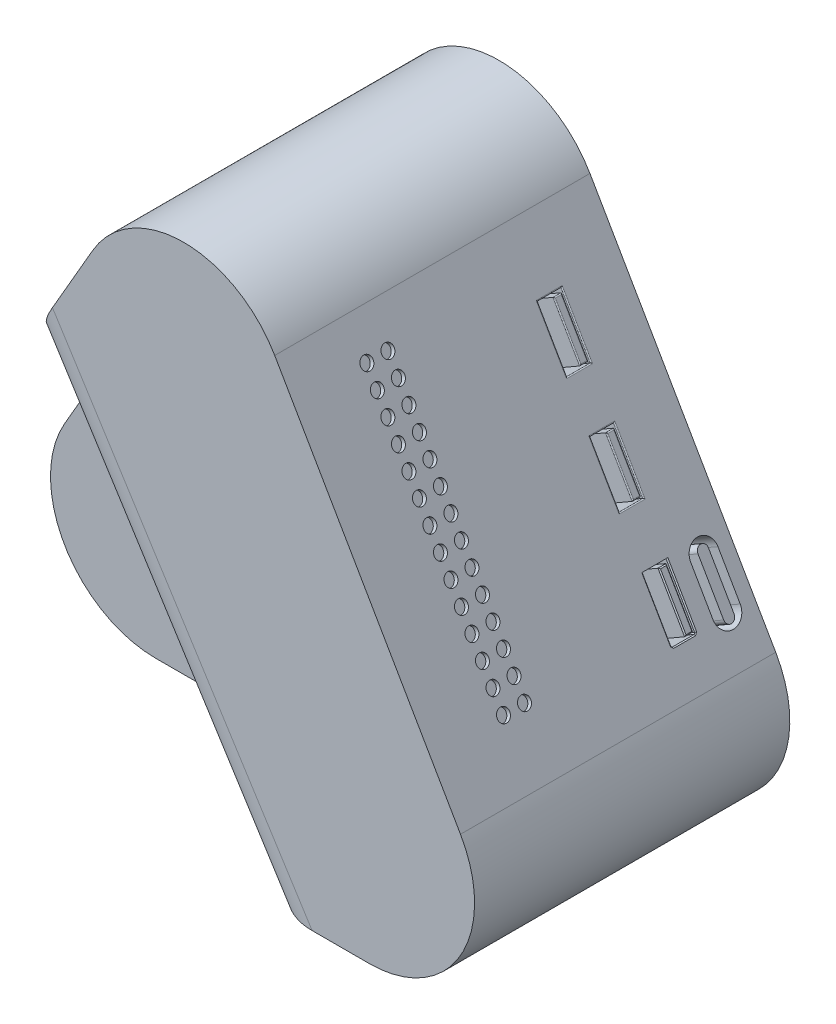
from build123d import *

# Parameters (mm, degrees)
BOSS_EXTRUDE1_DEPTH = 30
SKETCH2_W           = 2.275234404095272
SKETCH2_H           = 5.578757672765283
SKETCH2_H_2         = 5.578757672765278
SKETCH2_W_2         = 2.275234404095273
CUT_EXTRUDE1_DEPTH  = 5
SKETCH3_W           = 0.76212713524626
SKETCH3_H           = 5.066614641044968
SKETCH3_W_2         = 0.7621271352462609
SKETCH3_H_2         = 5.066614641044964
BOSS_EXTRUDE3_DEPTH = 5
CHAMFER2_SIZE       = 0.1
FILLET1_R           = 0.1
FILLET2_R           = 0.1
FILLET3_R           = 0.1
FILLET4_R           = 0.1
CUT_EXTRUDE2_DEPTH  = 5
BOSS_EXTRUDE4_DEPTH = 5
CUT_EXTRUDE3_START  = -15.000000000000002
CUT_EXTRUDE3_DEPTH  = 15.000000000000002
SKETCH7_W           = 4.440002623823602
SKETCH7_H           = 5.125420819496185
BOSS_EXTRUDE5_DEPTH = 0.4
SKETCH8_R           = 0.5886376526308733
BOSS_EXTRUDE6_DEPTH = 0.4
FILLET7_R           = 4
SKETCH10_R          = 0.5938831394244329
SKETCH10_R_2        = 0.5938831394244335
SKETCH10_R_3        = 0.5938831394244324
CUT_EXTRUDE4_DEPTH  = 0.4
FILLET8_R           = 4
BOSS_EXTRUDE7_DEPTH = 3
FILLET10_R          = 1


with BuildPart() as part:
    # Sketch1 → Boss-Extrude1 (new body)
    with BuildSketch(Plane.XY):
        with BuildLine():
            Line((-17.679491924311083, 3.18e-15), (17.6794919243111, 9.68e-15))
            ThreePointArc((17.6794919243111, 9.68e-15), (26.339745962155618, 5.000000000000008), (26.339745962155554, 15.000000000000124))
            Line((26.339745962155554, 15.000000000000124), (8.66025403784446, 45.621778264910596))
            ThreePointArc((8.66025403784446, 45.621778264910596), (6.34e-15, 50.621778264910716), (-8.660254037844458, 45.6217782649106))
            Line((-8.660254037844458, 45.6217782649106), (-26.339745962155547, 15.000000000000128))
            ThreePointArc((-26.339745962155547, 15.000000000000128), (-26.33974596215561, 5), (-17.679491924311083, 3.18e-15))
        make_face()
    extrude(amount=BOSS_EXTRUDE1_DEPTH)

    # Sketch2 → Cut-Extrude1 (cut)
    with BuildSketch(Plane(origin=(26.25000000000001, 15.155444566227686, 0), x_dir=(0, 0, -1), z_dir=(0.8660254037844386, 0.5000000000000001, 0))):
        with Locations((-6.771970321494826, 16.50011569419462)):
            Rectangle(SKETCH2_W, SKETCH2_H)
        with Locations((-6.771970321494791, 6.500115694194619)):
            Rectangle(SKETCH2_W, SKETCH2_H_2)
        with Locations((-6.771970321494861, 26.50011569419462)):
            Rectangle(SKETCH2_W_2, SKETCH2_H_2)
    extrude(amount=-CUT_EXTRUDE1_DEPTH, mode=Mode.SUBTRACT)

    # Sketch3 → Boss-Extrude3 (add)
    with BuildSketch(Plane(origin=(21.919872981077837, 12.655444566227697, 0), x_dir=(0, 0, -1), z_dir=(0.8660254037844385, 0.5000000000000003, 0))):
        with Locations((-6.16632950078614, 16.43387561929032)):
            Rectangle(SKETCH3_W, SKETCH3_H)
        with Locations((-6.166329500786105, 6.433875619290319)):
            Rectangle(SKETCH3_W_2, SKETCH3_H_2)
        with Locations((-6.166329500786173, 26.43387561929032)):
            Rectangle(SKETCH3_W_2, SKETCH3_H_2)
    extrude(amount=BOSS_EXTRUDE3_DEPTH)

    # Chamfer2
    chamfer2_edges = [part.edges().sort_by_distance(p)[0] for p in [
        (22.229568061632925, 17.119036951852106, 7.909587523542427),
        (20.064504552171826, 15.869036951852106, 6.771970321494791),
        (22.229568061632925, 17.119036951852106, 5.634353119447155),
        (22.9999421529027, 20.78470988493815, 7.909587523542427),
        (24.39463157109402, 18.369036951852106, 6.771970321494791),
        (22.9999421529027, 20.78470988493815, 5.634353119447155),
        (23.033062190354865, 20.727344297322453, 6.547393068409235),
        (24.29971585061611, 18.533435802156895, 6.166329500786105),
        (23.033062190354865, 20.727344297322453, 5.785265933162975),
        (21.766408530093624, 22.92125279248801, 6.166329500786105),
    ]]
    chamfer(chamfer2_edges, length=CHAMFER2_SIZE)

    # Fillet1
    fillet1_edges = [part.edges().sort_by_distance(p)[0] for p in [
        (19.299715850616106, 27.19368984000128, 6.16632950078614),
        (18.033062190354862, 29.387598335166835, 5.78526593316301),
        (16.76640853009362, 31.581506830332394, 6.16632950078614),
        (18.033062190354862, 29.387598335166835, 6.54739306840927),
    ]]
    fillet(fillet1_edges, radius=FILLET1_R)

    # Fillet2
    fillet2_edges = [part.edges().sort_by_distance(p)[0] for p in [
        (14.299715850616103, 35.853943877845666, 6.166329500786174),
        (13.03306219035486, 38.047852373011224, 5.785265933163044),
        (11.766408530093619, 40.241760868176776, 6.166329500786174),
        (13.03306219035486, 38.047852373011224, 6.547393068409304),
    ]]
    fillet(fillet2_edges, radius=FILLET2_R)

    # Fillet3
    fillet3_edges = [part.edges().sort_by_distance(p)[0] for p in [
        (19.394631571094017, 27.02929098969649, 6.771970321494826),
        (17.999942152902698, 29.444963922782534, 5.63435311944719),
        (16.605252734711378, 31.860636855868577, 6.771970321494826),
        (17.999942152902698, 29.444963922782534, 7.909587523542462),
    ]]
    fillet(fillet3_edges, radius=FILLET3_R)

    # Fillet4
    fillet4_edges = [part.edges().sort_by_distance(p)[0] for p in [
        (14.394631571094019, 35.68954502754087, 6.771970321494861),
        (12.999942152902698, 38.105217960626916, 5.634353119447224),
        (11.605252734711378, 40.52089089371296, 6.771970321494861),
        (12.999942152902698, 38.105217960626916, 7.909587523542497),
    ]]
    fillet(fillet4_edges, radius=FILLET4_R)

    # Sketch4 → Cut-Extrude2 (cut)
    with BuildSketch(Plane(origin=(26.25000000000001, 15.155444566227686, 0), x_dir=(0, 0, -1), z_dir=(0.8660254037844386, 0.5000000000000001, 0))):
        with BuildLine():
            Line((-3.8958432599542903, 3.970131617300865), (-3.8958432599542903, 8.204946525104617))
            ThreePointArc((-3.8958432599542903, 8.204946525104617), (-2.601063388610214, 9.499726396448693), (-1.306283517266138, 8.204946525104617))
            Line((-1.306283517266138, 8.204946525104617), (-1.306283517266138, 3.970131617300865))
            ThreePointArc((-1.306283517266138, 3.970131617300865), (-2.6010633886102146, 2.675351745956789), (-3.8958432599542903, 3.970131617300865))
        make_face()
    extrude(amount=-CUT_EXTRUDE2_DEPTH, mode=Mode.SUBTRACT)

    # Sketch5 → Boss-Extrude4 (add)
    with BuildSketch(Plane(origin=(21.919872981077813, 12.655444566227686, 0), x_dir=(0, 0, -1), z_dir=(0.8660254037844386, 0.5000000000000001, 0))):
        with BuildLine():
            Line((-3.0743032660907055, 3.583059523641907), (-3.0743032660907055, 8.465676524321175))
            ThreePointArc((-3.0743032660907055, 8.465676524321175), (-2.5777456783409036, 8.962234112070977), (-2.0811880905911018, 8.465676524321175))
            Line((-2.0811880905911018, 8.465676524321175), (-2.0811880905911018, 3.583059523641907))
            ThreePointArc((-2.0811880905911018, 3.583059523641907), (-2.5777456783409036, 3.0865019358921053), (-3.0743032660907055, 3.583059523641907))
        make_face()
    extrude(amount=BOSS_EXTRUDE4_DEPTH)

    # Sketch6 → Cut-Extrude3 (cut)
    with BuildSketch(Plane.XY.offset(30).offset(CUT_EXTRUDE3_START)):
        with BuildLine():
            Line((7.482900883826271, 7.11e-15), (-14.749507157804135, 35.07488248099315))
            Line((-14.749507157804127, 35.074882480993146), (-26.339745962155547, 15.000000000000131))
            ThreePointArc((-26.339745962155547, 15.000000000000128), (-26.339745962155618, 5.000000000000002), (-17.679491924311083, 1.78e-15))
            Line((-17.679491924311083, 3.18e-15), (7.482900883826272, 7.8e-15))
        make_face()
    extrude(amount=CUT_EXTRUDE3_DEPTH, mode=Mode.SUBTRACT)

    # Sketch7 → Boss-Extrude5 (add)
    with BuildSketch(Plane(origin=(5.338169454747117, 3.383628201109945, 0), x_dir=(0, 0, 1), z_dir=(-0.8446196510865366, -0.5353668321800086, 0))):
        with Locations((21.730667204522547, 17.27804822628798)):
            Rectangle(SKETCH7_W, SKETCH7_H)
    extrude(amount=BOSS_EXTRUDE5_DEPTH)

    # Sketch8 → Boss-Extrude6 (add)
    with BuildSketch(Plane(origin=(5.000321594312501, 3.169481468237942, 0), x_dir=(0, 0, 1), z_dir=(-0.8446196510865364, -0.5353668321800086, 0))):
        with Locations(Location((21.747310709322676, 17.2480877915433, 0), (0, 0, 90))):
            Circle(SKETCH8_R)
    extrude(amount=BOSS_EXTRUDE6_DEPTH)

    # Fillet7
    fillet7_edges = [part.edges().sort_by_distance(p)[0] for p in [
        (-3.633303136988933, 17.53744124049658, 14.999999999999998),
    ]]
    fillet(fillet7_edges, radius=FILLET7_R)

    # Sketch10 → Cut-Extrude4 (cut)
    with BuildSketch(Plane(origin=(26.25000000000001, 15.155444566227686, 0), x_dir=(0, 0, -1), z_dir=(0.8660254037844386, 0.5000000000000001, 0))):
        with Locations(Location((-23.062507434786994, 5.512963426255624, 0), (0, 0, 90))):
            Circle(SKETCH10_R)
        with Locations(Location((-21.062507434786994, 5.512963426255624, 0), (0, 0, 90))):
            Circle(SKETCH10_R)
        with Locations(Location((-21.062507434786998, 7.512963426255624, 0), (0, 0, 90))):
            Circle(SKETCH10_R)
        with Locations(Location((-21.062507434787005, 9.512963426255624, 0), (0, 0, 90))):
            Circle(SKETCH10_R)
        with Locations(Location((-21.062507434787012, 11.512963426255624, 0), (0, 0, 90))):
            Circle(SKETCH10_R)
        with Locations(Location((-21.06250743478702, 13.512963426255624, 0), (0, 0, 90))):
            Circle(SKETCH10_R)
        with Locations(Location((-21.062507434787026, 15.512963426255624, 0), (0, 0, 90))):
            Circle(SKETCH10_R)
        with Locations(Location((-21.062507434787033, 17.512963426255624, 0), (0, 0, 90))):
            Circle(SKETCH10_R_2)
        with Locations(Location((-21.06250743478704, 19.512963426255624, 0), (0, 0, 90))):
            Circle(SKETCH10_R_2)
        with Locations(Location((-21.062507434787047, 21.512963426255624, 0), (0, 0, 90))):
            Circle(SKETCH10_R_3)
        with Locations(Location((-21.062507434787054, 23.512963426255627, 0), (0, 0, 90))):
            Circle(SKETCH10_R_3)
        with Locations(Location((-21.06250743478706, 25.512963426255624, 0), (0, 0, 90))):
            Circle(SKETCH10_R_2)
        with Locations(Location((-21.06250743478707, 27.512963426255624, 0), (0, 0, 90))):
            Circle(SKETCH10_R_3)
        with Locations(Location((-21.062507434787076, 29.512963426255624, 0), (0, 0, 90))):
            Circle(SKETCH10_R_3)
        with Locations(Location((-21.062507434787083, 31.512963426255627, 0), (0, 0, 90))):
            Circle(SKETCH10_R_3)
        with Locations(Location((-23.062507434787, 7.512963426255624, 0), (0, 0, 90))):
            Circle(SKETCH10_R)
        with Locations(Location((-23.06250743478701, 9.512963426255624, 0), (0, 0, 90))):
            Circle(SKETCH10_R)
        with Locations(Location((-23.062507434787015, 11.512963426255624, 0), (0, 0, 90))):
            Circle(SKETCH10_R)
        with Locations(Location((-23.062507434787022, 13.512963426255624, 0), (0, 0, 90))):
            Circle(SKETCH10_R)
        with Locations(Location((-23.06250743478703, 15.512963426255624, 0), (0, 0, 90))):
            Circle(SKETCH10_R)
        with Locations(Location((-23.062507434787037, 17.512963426255624, 0), (0, 0, 90))):
            Circle(SKETCH10_R_2)
        with Locations(Location((-23.062507434787044, 19.512963426255624, 0), (0, 0, 90))):
            Circle(SKETCH10_R_2)
        with Locations(Location((-23.06250743478705, 21.512963426255624, 0), (0, 0, 90))):
            Circle(SKETCH10_R_3)
        with Locations(Location((-23.062507434787058, 23.512963426255627, 0), (0, 0, 90))):
            Circle(SKETCH10_R_3)
        with Locations(Location((-23.062507434787065, 25.512963426255624, 0), (0, 0, 90))):
            Circle(SKETCH10_R_2)
        with Locations(Location((-23.06250743478707, 27.512963426255624, 0), (0, 0, 90))):
            Circle(SKETCH10_R_3)
        with Locations(Location((-23.062507434787076, 29.512963426255624, 0), (0, 0, 90))):
            Circle(SKETCH10_R_3)
        with Locations(Location((-23.062507434787083, 31.512963426255627, 0), (0, 0, 90))):
            Circle(SKETCH10_R_3)
    extrude(amount=-CUT_EXTRUDE4_DEPTH, mode=Mode.SUBTRACT)

    # Fillet8
    fillet8_edges = [part.edges().sort_by_distance(p)[0] for p in [
        (-3.633303136988933, 17.53744124049658, 30),
    ]]
    fillet(fillet8_edges, radius=FILLET8_R)

    # Sketch11 → Boss-Extrude7 (add)
    with BuildSketch(Plane.XY.offset(14.999999999999998)):
        Polygon((-17.006968087908213, 31.16484545395118), (-18.366459113620724, 28.81013792498318), (0, 0), (2.747041382032401, 5e-16), align=None)
    extrude(amount=BOSS_EXTRUDE7_DEPTH)

    # Fillet10
    fillet10_edges = [part.edges().sort_by_distance(p)[0] for p in [
        (-18.366459113620724, 28.81013792498318, 16.5),
        (0, 0, 16.5),
        (-9.183229556810362, 14.40506896249159, 18),
    ]]
    fillet(fillet10_edges, radius=FILLET10_R)


solid = part.part
